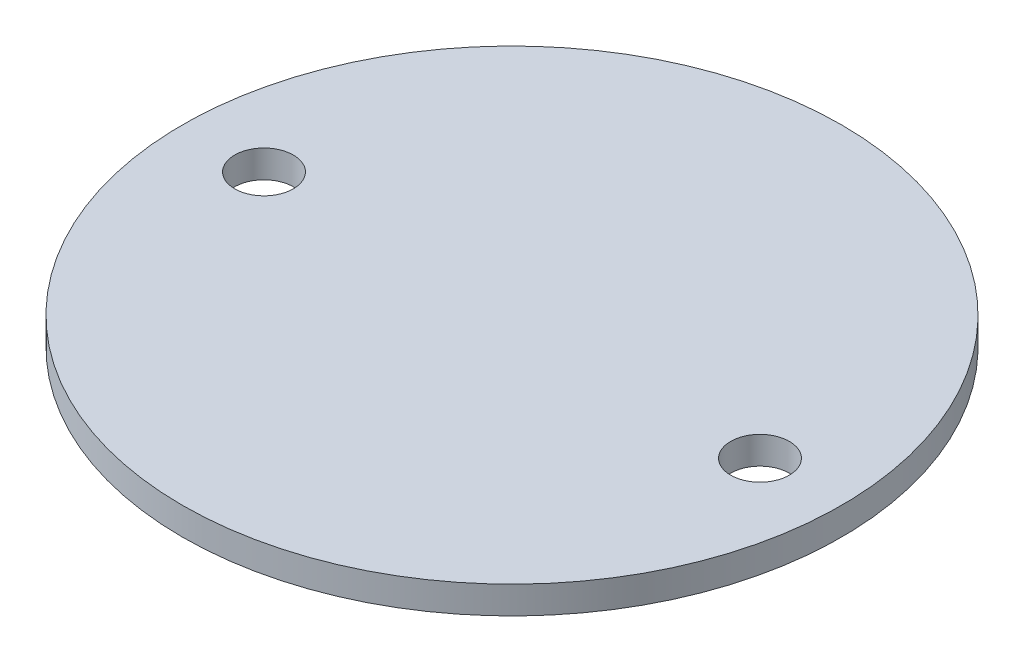
from build123d import *

# Parameters (mm, degrees)
SKETCH1_R                = 37.973
BOSS_EXTRUDE1_DEPTH      = 1.5875
H_0_266_DIAMETER_HOLE1_D = 6.7564


with BuildPart() as part:
    # Sketch1 → Boss-Extrude1 (new, symmetric)
    with BuildSketch(Plane(origin=(0, 0, 0), x_dir=(1, 0, 0), z_dir=(0, 1, 0))):
        with Locations(Location((0, 0, 0), (0, 0, 270))):
            Circle(SKETCH1_R)
    extrude(amount=BOSS_EXTRUDE1_DEPTH, both=True)

    # H (0.266) Diameter Hole1 (through all)
    with Locations(Plane(origin=(0, 1.5875, 0), x_dir=(1, 0, 0), z_dir=(0, 1, 0))):
        with Locations((-28.575, 0), (28.575, 0)):
            Hole(H_0_266_DIAMETER_HOLE1_D / 2)


solid = part.part
